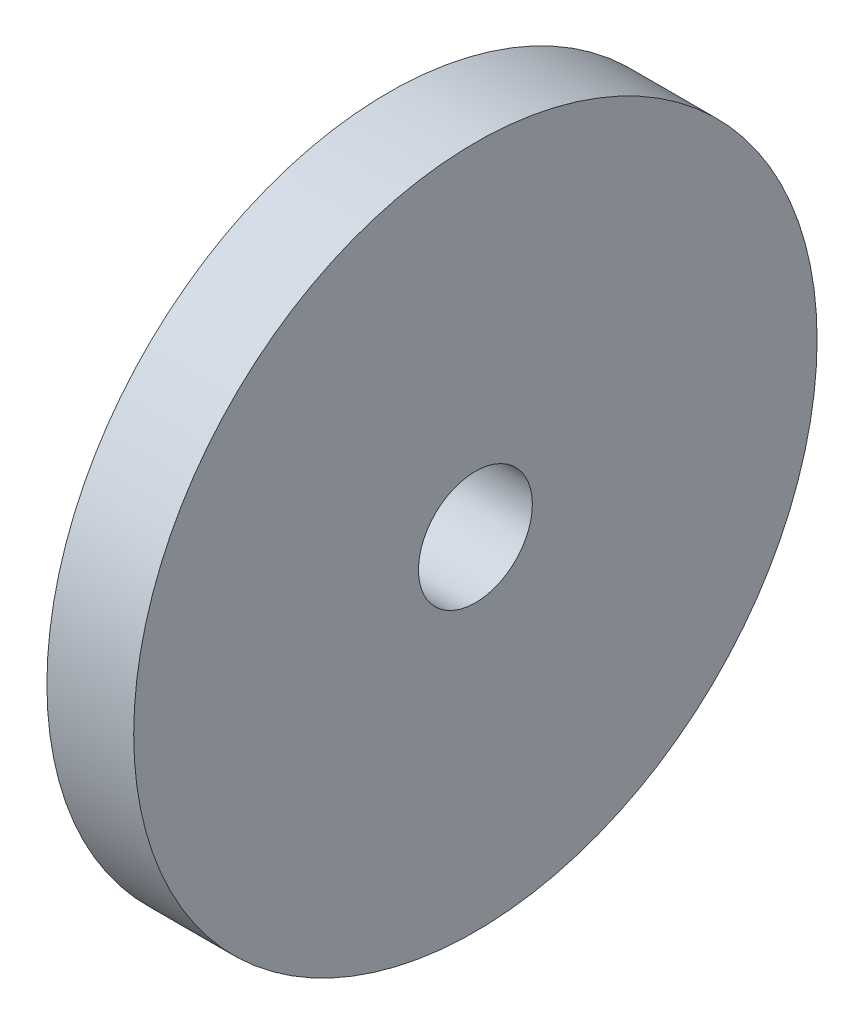
from build123d import *

# Parameters (mm, degrees)
ESQUISSE1_W             = 8
ESQUISSE1_H             = 31.5
ESQUISSE2_R             = 5.25
ENL_V_MAT_EXTRU_1_DEPTH = 10


with BuildPart() as part:
    # Esquisse1 → Révolution1 (revolve)
    with BuildSketch(Plane(origin=(0, 0, 0), x_dir=(1, 0, 0), z_dir=(0, 1, 0)), mode=Mode.PRIVATE) as r_volution1_sk:
        with Locations((4, 15.75)):
            Rectangle(ESQUISSE1_W, ESQUISSE1_H)
    revolve(r_volution1_sk.sketch.rotate(Axis((8, 0, -31.5), (-1, 0, 0)), 180), axis=Axis((8, 0, -31.5), (-1, 0, 0)))

    # Esquisse2 → Enlèv. mat.-Extru.1 (cut)
    with BuildSketch(Plane(origin=(8, 0, 0), x_dir=(0, 0, -1), z_dir=(1, 0, 0))):
        with Locations((31.5, 0)):
            Circle(ESQUISSE2_R)
    extrude(amount=-ENL_V_MAT_EXTRU_1_DEPTH, mode=Mode.SUBTRACT)


solid = part.part
